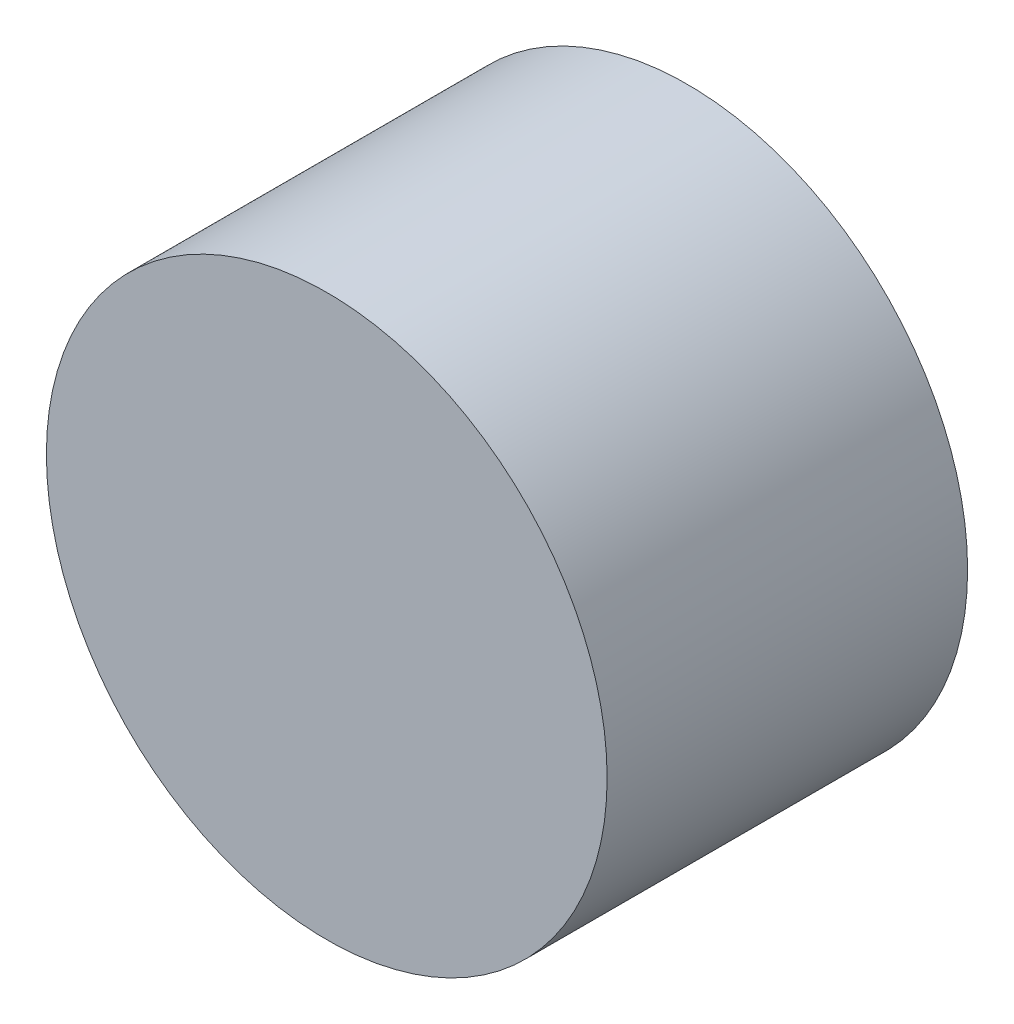
from build123d import *

# Parameters (mm, degrees)
SKETCH_1_R      = 14
EXTRUDE_1_DEPTH = 18


with BuildPart() as part:
    # 草图1 → 凸台-拉伸1 (new body)
    with BuildSketch(Plane.XY):
        Circle(SKETCH_1_R)
    extrude(amount=EXTRUDE_1_DEPTH)


solid = part.part
